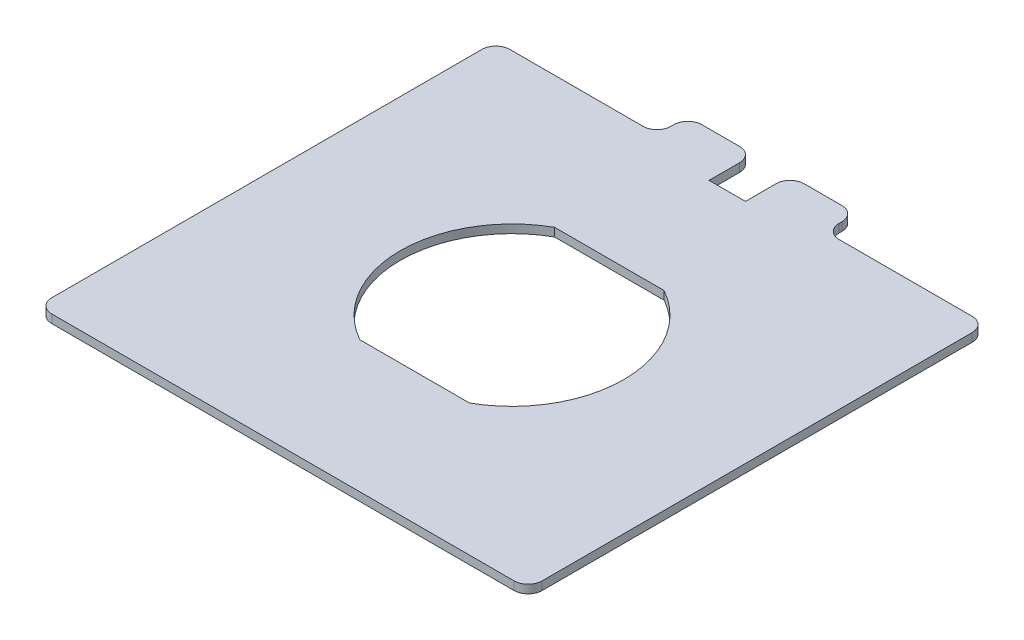
from build123d import *

# Parameters (mm, degrees)
BOSS_EXTRU_1_DEPTH      = 0.6
ESQUISSE2_W             = 117.961397218
ESQUISSE2_H             = 91.146128779
ESQUISSE2_W_2           = 35
ESQUISSE2_H_2           = 51.049946684
ENL_V_MAT_EXTRU_1_DEPTH = 47.375774926
CONG_1_R                = 1
ENL_V_MAT_EXTRU_2_DEPTH = 26.509067015


with BuildPart() as part:
    # Esquisse1 → Boss.-Extru.1 (new body)
    with BuildSketch(Plane(origin=(0, 0, 0), x_dir=(1, 0, 0), z_dir=(0, 1, 0))):
        with BuildLine():
            Line((7, 16.35), (39.5, 16.35))
            ThreePointArc((39.5, 16.35), (41.621320344, 15.471320344), (42.5, 13.35))
            Line((42.5, 13.35), (42.5, -13.35))
            ThreePointArc((42.5, -13.35), (41.621320344, -15.471320344), (39.5, -16.35))
            Line((39.5, -16.35), (-39.5, -16.35))
            ThreePointArc((-39.5, -16.35), (-41.621320344, -15.471320344), (-42.5, -13.35))
            Line((-42.5, -13.35), (-42.5, 13.35))
            ThreePointArc((-42.5, 13.35), (-41.621320344, 15.471320344), (-39.5, 16.35))
            Line((-39.5, 16.35), (-7, 16.35))
            ThreePointArc((-7, 16.35), (-6.292893219, 16.642893219), (-6, 17.35))
            Line((-6, 17.35), (-6, 17.55))
            ThreePointArc((-6, 17.55), (-5.707106781, 18.257106781), (-5, 18.55))
            Line((-5, 18.55), (-2.3, 18.55))
            ThreePointArc((-2.3, 18.55), (-1.592893219, 18.257106781), (-1.3, 17.55))
            Line((-1.3, 17.55), (-1.3, 15.362970147))
            Line((-1.3, 15.362970147), (1.3, 15.362970147))
            Line((1.3, 15.362970147), (1.3, 17.55))
            ThreePointArc((1.3, 17.55), (1.592893219, 18.257106781), (2.3, 18.55))
            Line((2.3, 18.55), (5, 18.55))
            ThreePointArc((5, 18.55), (5.707106781, 18.257106781), (6, 17.55))
            Line((6, 17.55), (6, 17.35))
            ThreePointArc((6, 17.35), (6.292893219, 16.642893219), (7, 16.35))
        make_face()
        with BuildLine():
            Line((-3.87177285, 6.8), (3.87177285, 6.8))
            ThreePointArc((3.87177285, 6.8), (7.825, 0), (3.87177285, -6.8))
            Line((3.87177285, -6.8), (-3.87177285, -6.8))
            ThreePointArc((-3.87177285, -6.8), (-7.825, 0), (-3.87177285, 6.8))
        make_face(mode=Mode.SUBTRACT)
    extrude(amount=BOSS_EXTRU_1_DEPTH)

    # Esquisse2 → Enlèv. mat.-Extru.1 (cut, through all)
    with BuildSketch(Plane(origin=(0, 0.6, 0), x_dir=(1, 0, 0), z_dir=(0, 1, 0))):
        with Locations((-0.999168038, 1.097201222)):
            Rectangle(ESQUISSE2_W, ESQUISSE2_H)
        Rectangle(ESQUISSE2_W_2, ESQUISSE2_H_2, mode=Mode.SUBTRACT)
    extrude(amount=-ENL_V_MAT_EXTRU_1_DEPTH, mode=Mode.SUBTRACT)

    # Congé1
    cong_1_edges = [part.edges().sort_by_distance(p)[0] for p in [
        (-17.5, 0.3, -16.35),
        (17.5, 0.3, -16.35),
        (17.5, 0.3, 16.35),
        (-17.5, 0.3, 16.35),
    ]]
    fillet(cong_1_edges, radius=CONG_1_R)

    # Esquisse3 → Enlèv. mat.-Extru.2 (cut, through all)
    with BuildSketch(Plane(origin=(0, 0.6, 0), x_dir=(1, 0, 0), z_dir=(0, 1, 0))):
        with BuildLine():
            Line((-3.911281759, -6.95), (3.911281759, -6.95))
            ThreePointArc((3.911281759, -6.95), (7.975, 0), (3.911281759, 6.95))
            Line((3.911281759, 6.95), (-3.911281759, 6.95))
            ThreePointArc((-3.911281759, 6.95), (-7.975, 0), (-3.911281759, -6.95))
        make_face()
    extrude(amount=-ENL_V_MAT_EXTRU_2_DEPTH, mode=Mode.SUBTRACT)


solid = part.part
